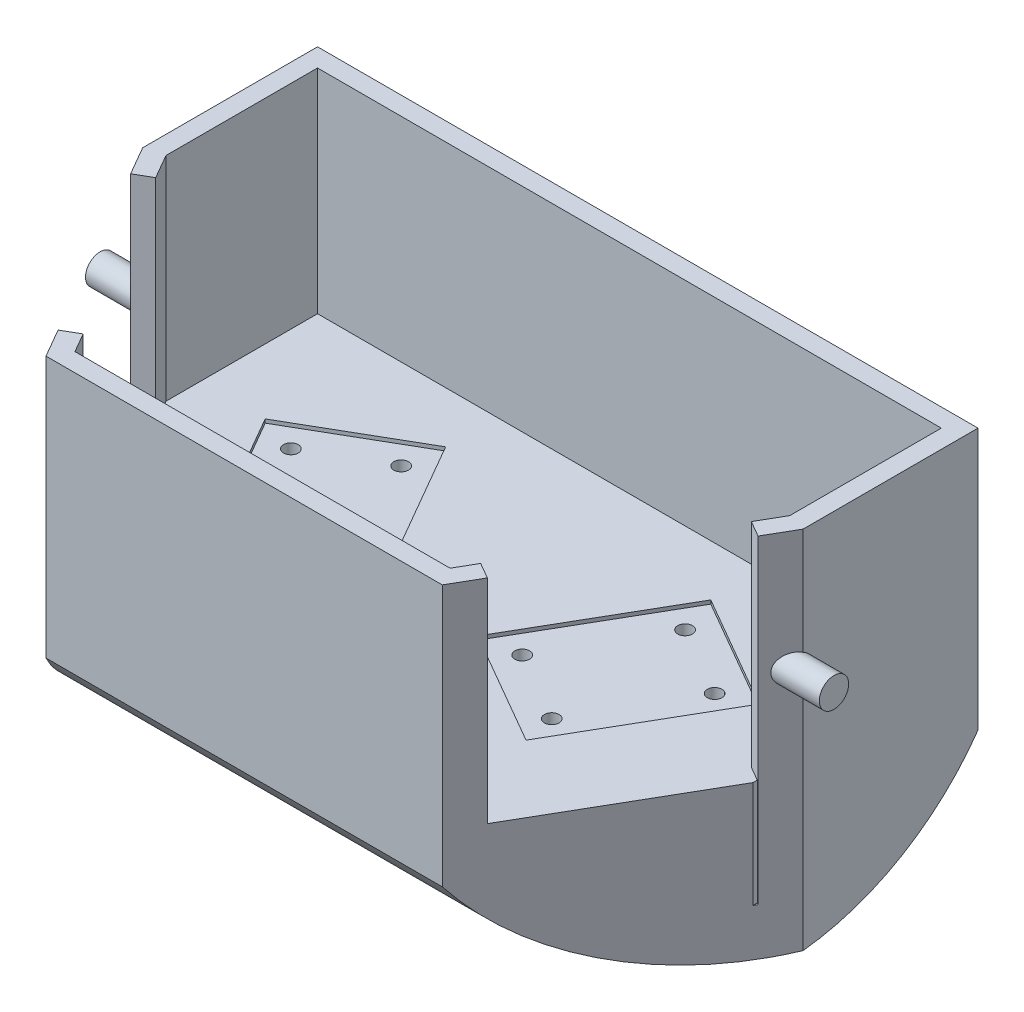
from build123d import *

# Parameters (mm, degrees)
BOSS_EXTRUDE1_DEPTH             = 50
BOSS_EXTRUDE1_DEPTH_BACK        = 50
CUT_EXTRUDE9_REACH              = 196.743
SHELL1_T                        = -5
SKETCH5_W                       = 54
SKETCH5_H                       = 87
CUT_EXTRUDE2_DEPTH              = 5
BOSS_EXTRUDE4_REACH             = 192.132
SKETCH6_R                       = 2
CUT_EXTRUDE4_DEPTH              = 121.370262108
SKETCH6_4_R                     = 2
CUT_EXTRUDE5_DEPTH              = 1
CUT_EXTRUDE10_REACH             = 122.37
SKETCH18_R                      = 4
BOSS_EXTRUDE5_DEPTH             = 10
BOSS_EXTRUDE5_DIRECTION_2_REACH = 196.743


with BuildPart() as part:
    # Sketch2 → Boss-Extrude1 (new, two sides: drawn at the far end of the back side and taken through both)
    with BuildSketch(Plane(origin=(0, 0, 0), x_dir=(1, 0, 0), z_dir=(0, 1, 0)).offset(-BOSS_EXTRUDE1_DEPTH_BACK)):
        Polygon((-90, 7.353829072), (-54, -55), (54, -55), (90, 7.353829072), (90, 55), (-90, 55), align=None)
    extrude(amount=BOSS_EXTRUDE1_DEPTH + BOSS_EXTRUDE1_DEPTH_BACK)

    # Sketch13 → Cut-Extrude9 (cut, up to next)
    with BuildSketch(Plane.ZY.offset(90), mode=Mode.PRIVATE) as cut_extrude9_sk1:
        with BuildLine():
            Line((-55, -21.268810449), (-55, -50))
            Line((-55, -50), (-7.353829072, -50))
            Line((-7.353829072, -50), (-7.353829072, -49.496068946))
            ThreePointArc((-7.353829072, -49.496068946), (-34.222719509, -40.523602958), (-55, -21.268810449))
        make_face()
    cut_extrude9_tool1 = extrude(cut_extrude9_sk1.sketch, amount=-CUT_EXTRUDE9_REACH, mode=Mode.PRIVATE) & part.part
    # Sketch13 → Cut-Extrude9 (cut, up to next)
    with BuildSketch(Plane.ZY.offset(90), mode=Mode.PRIVATE) as cut_extrude9_sk2:
        with BuildLine():
            Line((-7.353829072, -49.496068946), (-7.353829072, -50))
            Line((-7.353829072, -50), (55, -50))
            Line((55, -50), (55, -21.268810449))
            ThreePointArc((55, -21.268810449), (27.689960845, -43.924342078), (-7.353829072, -49.496068946))
        make_face()
    cut_extrude9_tool2 = extrude(cut_extrude9_sk2.sketch, amount=-CUT_EXTRUDE9_REACH, mode=Mode.PRIVATE) & part.part
    add(cut_extrude9_tool1.solids().sort_by_distance((-90, -41.817219, -41.87257))[0], mode=Mode.SUBTRACT)
    add(cut_extrude9_tool2.solids().sort_by_distance((-90, -41.875278, 41.569998))[0], mode=Mode.SUBTRACT)

    # Shell1
    shell1_openings = [part.faces().sort_by_distance(p)[0] for p in [
        (0, 50, -4.375017638),
    ]]
    offset(amount=SHELL1_T, openings=shell1_openings, kind=Kind.INTERSECTION)

    # Sketch5 → Cut-Extrude2 (cut)
    with BuildSketch(Plane(origin=(-64.315698604, 0, 37.132685902), x_dir=(0.500000000000001, 0, 0.8660254037844382), z_dir=(-0.866025403784438, 0, 0.5000000000000009))):
        with Locations((-15.368602792, 6.5)):
            Rectangle(SKETCH5_W, SKETCH5_H)
    cut_extrude2 = extrude(amount=-CUT_EXTRUDE2_DEPTH, mode=Mode.SUBTRACT)

    # Mirror1: Cut-Extrude2 across plane
    add(cut_extrude2.mirror(Plane(origin=(0, 0, 0), x_dir=(0, 0, 1), z_dir=(1, 0, 0))), mode=Mode.SUBTRACT)

    # Boss-Extrude4: up to this face of the body (flat: up to its plane)
    boss_extrude4_end = Plane(part.part.faces().sort_by_distance((85, 6.834453574, -28.402154485))[0])
    # Sketch16 → Boss-Extrude4 (add, up to the picked face)
    with BuildSketch(Plane(origin=(-85, 0, 0), x_dir=(0, 0, -1), z_dir=(1, 0, 0)), mode=Mode.PRIVATE) as boss_extrude4_sk1:
        with BuildLine():
            Line((-55, -8), (55, -8))
            Line((55, -8), (55, -21.268810449))
            ThreePointArc((55, -21.268810449), (0, -49.9), (-55, -21.268810449))
            Line((-55, -21.268810449), (-55, -8))
        make_face()
    boss_extrude4_tool1 = split(extrude(boss_extrude4_sk1.sketch, amount=BOSS_EXTRUDE4_REACH, mode=Mode.PRIVATE), bisect_by=boss_extrude4_end, keep=Keep.BOTH, mode=Mode.PRIVATE)
    add(boss_extrude4_tool1.solids().sort_by(Axis((-85, -25.669954, 0), (1, 0, 0)))[0])

    # Sketch6 → Cut-Extrude4 (cut, through all)
    with BuildSketch(Plane(origin=(0, -8, 0), x_dir=(1, 0, 0), z_dir=(0, 1, 0))):
        with Locations(Location((-57.742314098, 15.481878155, 0), (0, 0, 270))):
            Circle(SKETCH6_R)
        with Locations(Location((-38.689755215, 26.481878155, 0), (0, 0, 270))):
            Circle(SKETCH6_R)
        with Locations(Location((-41.492314098, -12.663947468, 0), (0, 0, 270))):
            Circle(SKETCH6_R)
        with Locations(Location((-22.439755215, -1.663947468, 0), (0, 0, 270))):
            Circle(SKETCH6_R)
        with Locations(Location((22.439755215, -1.663947468, 0), (0, 0, 56.302025246))):
            Circle(SKETCH6_R)
        with Locations(Location((41.492314098, -12.663947468, 0), (0, 0, 270))):
            Circle(SKETCH6_R)
        with Locations(Location((38.689755215, 26.481878155, 0), (0, 0, 270))):
            Circle(SKETCH6_R)
        with Locations(Location((57.742314098, 15.481878155, 0), (0, 0, 270))):
            Circle(SKETCH6_R)
    extrude(amount=-CUT_EXTRUDE4_DEPTH, mode=Mode.SUBTRACT)

    # Sketch6<4> → Cut-Extrude5 (cut)
    # profile 1 of 2: a face of its own
    with BuildSketch(Plane(origin=(0, -8, 0), x_dir=(1, 0, 0), z_dir=(0, 1, 0))):
        Polygon((36.127577388, 36.044055982), (67.304491924, 18.044055982), (44.054491924, -22.226125294), (12.877577388, -4.226125294), align=None)
        with Locations(Location((38.689755215, 26.481878155, 0), (0, 0, 270))):
            Circle(SKETCH6_4_R, mode=Mode.SUBTRACT)
        with Locations(Location((22.439755215, -1.663947468, 0), (0, 0, 270))):
            Circle(SKETCH6_4_R, mode=Mode.SUBTRACT)
        with Locations(Location((41.492314098, -12.663947468, 0), (0, 0, 270))):
            Circle(SKETCH6_4_R, mode=Mode.SUBTRACT)
        with Locations(Location((57.742314098, 15.481878155, 0), (0, 0, 270))):
            Circle(SKETCH6_4_R, mode=Mode.SUBTRACT)
    # profile 2 of 2: a face of its own
    with BuildSketch(Plane(origin=(0, -8, 0), x_dir=(1, 0, 0), z_dir=(0, 1, 0))):
        Polygon((-36.127577388, 36.044055982), (-12.877577388, -4.226125294), (-44.054491924, -22.226125294), (-67.304491924, 18.044055982), align=None)
    extrude(amount=-CUT_EXTRUDE5_DEPTH, mode=Mode.SUBTRACT)

    # Sketch17 → Cut-Extrude10 (cut, up to next)
    with BuildSketch(Plane(origin=(0, -8, 0), x_dir=(1, 0, 0), z_dir=(0, 1, 0)), mode=Mode.PRIVATE) as cut_extrude10_sk1:
        Polygon((-54, -55), (-85, -55), (-85, -1.306424965), align=None)
    cut_extrude10_tool1 = extrude(cut_extrude10_sk1.sketch, amount=-CUT_EXTRUDE10_REACH, mode=Mode.PRIVATE) & part.part
    # Sketch17 → Cut-Extrude10 (cut, up to next)
    with BuildSketch(Plane(origin=(0, -8, 0), x_dir=(1, 0, 0), z_dir=(0, 1, 0)), mode=Mode.PRIVATE) as cut_extrude10_sk2:
        Polygon((85, -55), (54, -55), (85, -1.306424965), align=None)
    cut_extrude10_tool2 = extrude(cut_extrude10_sk2.sketch, amount=-CUT_EXTRUDE10_REACH, mode=Mode.PRIVATE) & part.part
    add(cut_extrude10_tool1.solids().sort_by_distance((-74.666667, -8, 37.102142))[0], mode=Mode.SUBTRACT)
    add(cut_extrude10_tool2.solids().sort_by_distance((74.666667, -8, 37.102142))[0], mode=Mode.SUBTRACT)

    # Sketch18 → Boss-Extrude5 (add)
    with BuildSketch(Plane.ZY.offset(90)):
        with Locations((-5.755783353, 17.2426)):
            Circle(SKETCH18_R)
    boss_extrude5 = extrude(amount=BOSS_EXTRUDE5_DEPTH)

    # Sketch18 → Boss-Extrude5 direction 2 (add, up to next)
    with BuildSketch(Plane.ZY.offset(90), mode=Mode.PRIVATE) as boss_extrude5_direction_2_sk1:
        with Locations((-5.755783353, 17.2426)):
            Circle(SKETCH18_R)
    boss_extrude5_direction_2_tool1 = extrude(boss_extrude5_direction_2_sk1.sketch, amount=-BOSS_EXTRUDE5_DIRECTION_2_REACH, mode=Mode.PRIVATE) - part.part
    boss_extrude5_direction_2 = boss_extrude5_direction_2_tool1.solids().sort_by_distance((-90, 17.2426, -5.755783))[0]
    add(boss_extrude5_direction_2)

    # Mirror2: Boss-Extrude5, Boss-Extrude5 direction 2 across plane
    add(boss_extrude5.mirror(Plane(origin=(0, 0, 0), x_dir=(0, 0, 1), z_dir=(1, 0, 0))))
    add(boss_extrude5_direction_2.mirror(Plane(origin=(0, 0, 0), x_dir=(0, 0, 1), z_dir=(1, 0, 0))))


solid = part.part
